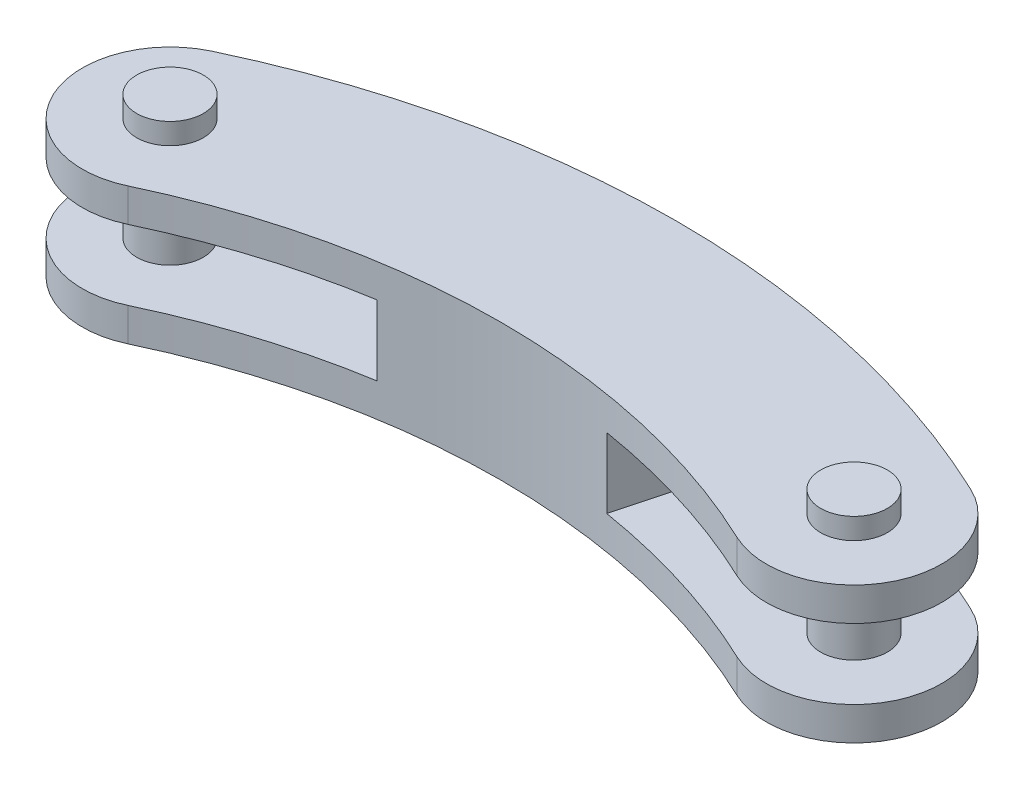
from build123d import *

# Parameters (mm, degrees)
BOSS_EXTRUDE1_DEPTH   = 9.5
BOSS_EXTRUDE2_DEPTH   = 20
BOSS_EXTRUDE3_DEPTH   = 9.5
SKETCH4_R             = 9.5
CUT_EXTRUDE1_DEPTH    = 137.845668985
BOSS_EXTRUDE4_START   = 6
SKETCH4_2_R           = 9.5
BOSS_EXTRUDE4_DEPTH   = 50
BOSS_EXTRUDE4_2_DEPTH = 50


with BuildPart() as part:
    # Sketch1 → Boss-Extrude1 (new body)
    with BuildSketch(Plane(origin=(0, 0, 0), x_dir=(1, 0, 0), z_dir=(0, 1, 0))):
        with BuildLine():
            ThreePointArc((108.190789474, 0.700137895), (0, 25), (-108.190789474, 0.700137895))
            ThreePointArc((-108.190789474, 0.700137895), (-120.098827855, -32.589479434), (-86.809210526, -44.497517816))
            ThreePointArc((-86.809210526, -44.497517816), (0, -25), (86.809210526, -44.497517816))
            ThreePointArc((86.809210526, -44.497517816), (120.098827855, -32.589479434), (108.190789474, 0.700137895))
        make_face()
    extrude(amount=BOSS_EXTRUDE1_DEPTH)

    # Sketch2 → Boss-Extrude2 (add)
    with BuildSketch(Plane(origin=(0, 9.5, 0), x_dir=(1, 0, 0), z_dir=(0, 1, 0))):
        with BuildLine():
            ThreePointArc((45.772423296, 20.825009325), (0, 25), (-45.772423296, 20.825009325))
            Line((-45.772423296, 20.825009325), (-32.779812988, -27.664072467))
            ThreePointArc((-32.779812988, -27.664072467), (0, -25), (32.779812988, -27.664072467))
            Line((32.779812988, -27.664072467), (45.772423296, 20.825009325))
        make_face()
    extrude(amount=BOSS_EXTRUDE2_DEPTH)

    # Sketch3 → Boss-Extrude3 (add)
    with BuildSketch(Plane(origin=(0, 29.5, 0), x_dir=(1, 0, 0), z_dir=(0, 1, 0))):
        with BuildLine():
            ThreePointArc((108.190789474, 0.700137895), (0, 25), (-108.190789474, 0.700137895))
            ThreePointArc((-108.190789474, 0.700137895), (-120.098827855, -32.589479434), (-86.809210526, -44.497517816))
            ThreePointArc((-86.809210526, -44.497517816), (0, -25), (86.809210526, -44.497517816))
            ThreePointArc((86.809210526, -44.497517816), (120.098827855, -32.589479434), (108.190789474, 0.700137895))
        make_face()
    extrude(amount=BOSS_EXTRUDE3_DEPTH)

    # Sketch4 → Cut-Extrude1 (cut, through all)
    with BuildSketch(Plane(origin=(0, 39, 0), x_dir=(1, 0, 0), z_dir=(0, 1, 0))):
        with Locations((-97.5, -21.89868996)):
            Circle(SKETCH4_R)
        with Locations((97.5, -21.89868996)):
            Circle(SKETCH4_R)
    extrude(amount=-CUT_EXTRUDE1_DEPTH, mode=Mode.SUBTRACT)


with BuildPart() as body_2:
    # Sketch4<2> → Boss-Extrude4 (new body)
    with BuildSketch(Plane(origin=(0, 39, 0), x_dir=(1, 0, 0), z_dir=(0, 1, 0)).offset(BOSS_EXTRUDE4_START)):
        with Locations((-97.5, -21.89868996)):
            Circle(SKETCH4_2_R)
    extrude(amount=-BOSS_EXTRUDE4_DEPTH)


with BuildPart() as body_3:
    # Sketch4<2> → Boss-Extrude4 2 (new body)
    with BuildSketch(Plane(origin=(0, 39, 0), x_dir=(1, 0, 0), z_dir=(0, 1, 0)).offset(BOSS_EXTRUDE4_START)):
        with Locations((97.5, -21.89868996)):
            Circle(SKETCH4_2_R)
    extrude(amount=-BOSS_EXTRUDE4_2_DEPTH)


solid = Compound([part.part, body_2.part, body_3.part])
